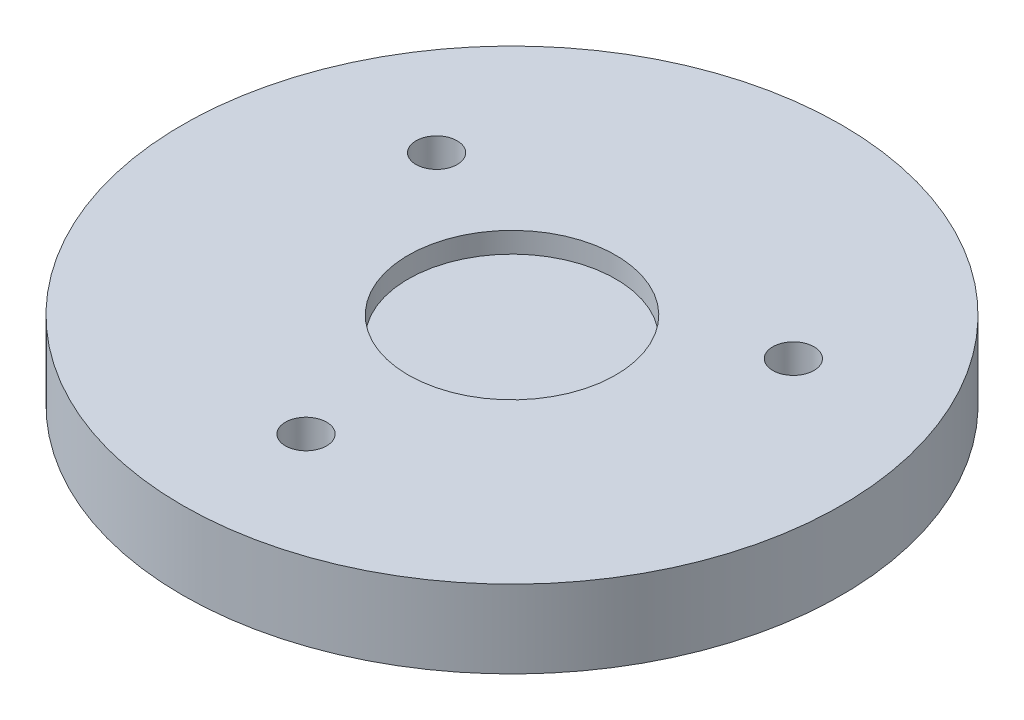
from build123d import *

# Parameters (mm, degrees)
SKETCH1_R           = 50.8
BOSS_EXTRUDE1_DEPTH = 11.9888
SKETCH3_R           = 3.175
CUT_EXTRUDE1_DEPTH  = 73.835508685
CIRPATTERN1_COUNT   = 3
SKETCH4_R           = 16.002
CUT_EXTRUDE2_DEPTH  = 3.175


with BuildPart() as part:
    # Sketch1 → Boss-Extrude1 (new body)
    with BuildSketch(Plane(origin=(0, 0, 0), x_dir=(1, 0, 0), z_dir=(0, 1, 0))):
        Circle(SKETCH1_R)
    extrude(amount=BOSS_EXTRUDE1_DEPTH)

    # Sketch3 → Cut-Extrude1 (cut, through all)
    with BuildSketch(Plane.XZ):
        with Locations((0, 31.75)):
            Circle(SKETCH3_R)
    cut_extrude1 = extrude(amount=-CUT_EXTRUDE1_DEPTH, mode=Mode.SUBTRACT)

    # CirPattern1: Cut-Extrude1 ×3 about axis
    cirpattern1_axis = Axis((0, 0, 0), (0, -1, 0))
    for i in range(1, CIRPATTERN1_COUNT):
        add(cut_extrude1.rotate(cirpattern1_axis, i * 360 / CIRPATTERN1_COUNT), mode=Mode.SUBTRACT)

    # Sketch4 → Cut-Extrude2 (cut)
    with BuildSketch(Plane(origin=(0, 11.9888, 0), x_dir=(1, 0, 0), z_dir=(0, 1, 0))):
        Circle(SKETCH4_R)
    extrude(amount=-CUT_EXTRUDE2_DEPTH, mode=Mode.SUBTRACT)


solid = part.part
